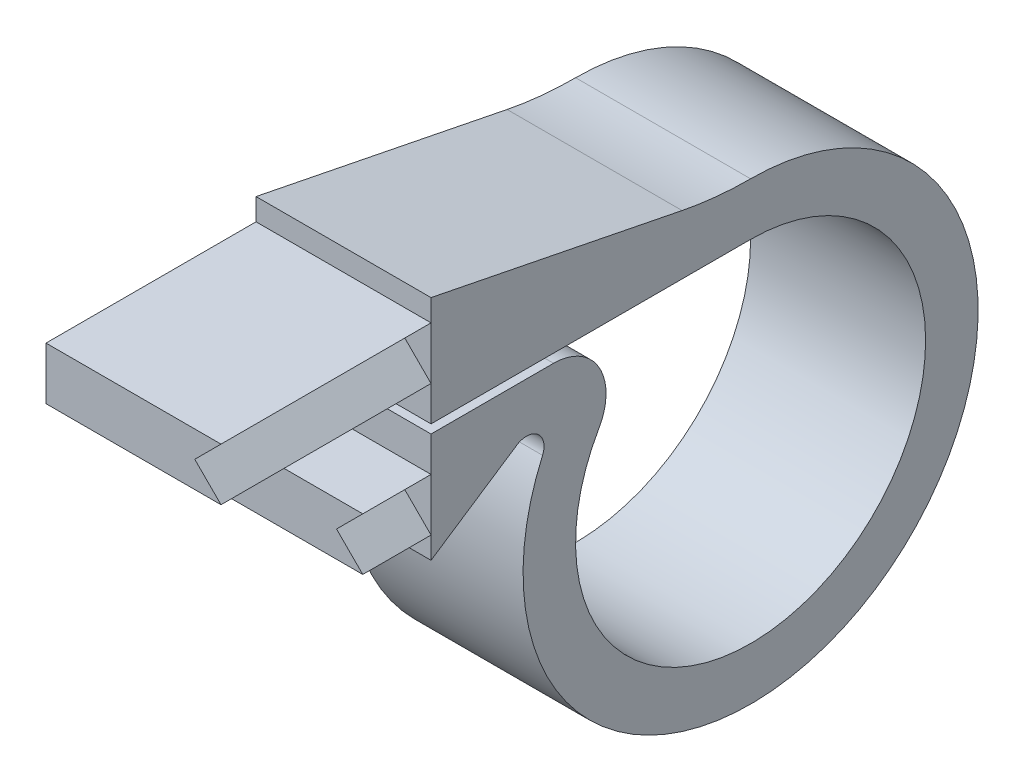
from build123d import *

# Parameters (mm, degrees)
BOSS_EXTRUDE1_DEPTH = 10
BOSS_EXTRUDE4_DEPTH = 12
SKETCH6_W           = 8.1
SKETCH6_H           = 3
CUT_EXTRUDE2_DEPTH  = 12


with BuildPart() as part:
    # Sketch1 → Boss-Extrude1 (new body)
    with BuildSketch(Plane(origin=(0, 0, 0), x_dir=(0, 0, -1), z_dir=(1, 0, 0))):
        with BuildLine():
            Line((-11.258330249, -0.5), (-18.258330249, -0.5))
            Line((-18.258330249, -0.5), (-18.258330249, -6.75))
            Line((-18.258330249, -6.75), (-13.354440804, -3.5))
            ThreePointArc((-13.354440804, -3.5), (-12.156943399, -3.569431047), (-11.887579875, -4.738304007))
            ThreePointArc((-11.887579875, -4.738304007), (7.092177102, -20.894999952), (0, 3))
            ThreePointArc((0, 3), (-1.967023285, 3.096964568), (-3.914973414, 3.38691806))
            Line((-3.914973414, 3.38691806), (-18.258330249, 6.25))
            Line((-18.258330249, 6.25), (-18.258330249, 0))
            Line((-18.258330249, 0), (0, 0))
            ThreePointArc((0, 0), (5, -18.660254038), (-8.660254038, -5))
            ThreePointArc((-8.660254038, -5), (-8.660254038, -2), (-11.258330249, -0.5))
        make_face()
    extrude(amount=BOSS_EXTRUDE1_DEPTH)

    # Sketch2 → Boss-Extrude4 (add)
    with BuildSketch(Plane.XY.offset(18.258330249)):
        Polygon((0, 2), (10, 2), (8.5, 3.5), (10, 5), (0, 5), align=None)
        Polygon((0, -5.5), (10, -5.5), (8.5, -4), (10, -2.5), (0, -2.5), align=None)
    extrude(amount=BOSS_EXTRUDE4_DEPTH)

    # Sketch6 → Cut-Extrude2 (cut)
    with BuildSketch(Plane.ZY):
        with Locations((26.208330249, -4)):
            Rectangle(SKETCH6_W, SKETCH6_H)
    extrude(amount=-CUT_EXTRUDE2_DEPTH, mode=Mode.SUBTRACT)


solid = part.part
